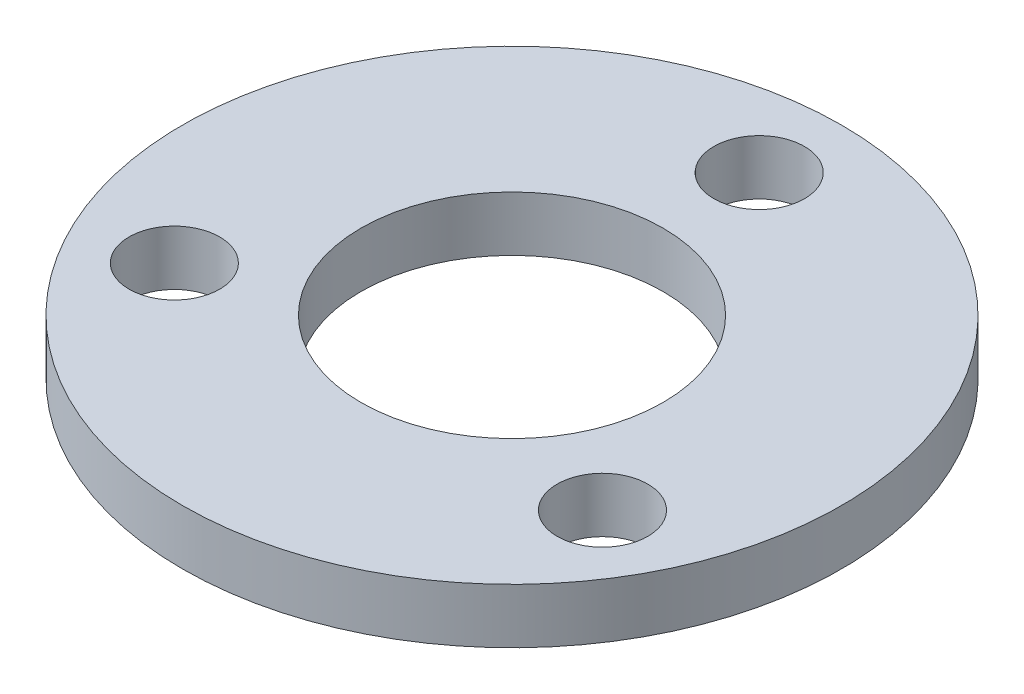
from build123d import *

# Parameters (mm, degrees)
SKETCH_1_R      = 12
SKETCH_1_R_2    = 1.65
SKETCH_1_R_3    = 5.5
EXTRUDE_1_DEPTH = 2


with BuildPart() as part:
    # Эскиз1 → Бобышка-Вытянуть1 (new body)
    with BuildSketch(Plane(origin=(0, 0, 0), x_dir=(1, 0, 0), z_dir=(0, 1, 0))):
        with Locations(Location((0, 0, 0), (0, 0, 270))):
            Circle(SKETCH_1_R)
        with Locations(Location((0, 9, 0), (0, 0, 270))):
            Circle(SKETCH_1_R_2, mode=Mode.SUBTRACT)
        with Locations(Location((7.794228634, -4.5, 0), (0, 0, 270))):
            Circle(SKETCH_1_R_2, mode=Mode.SUBTRACT)
        with Locations(Location((-7.794228634, -4.5, 0), (0, 0, 270))):
            Circle(SKETCH_1_R_2, mode=Mode.SUBTRACT)
        with Locations(Location((0, 0, 0), (0, 0, 270))):
            Circle(SKETCH_1_R_3, mode=Mode.SUBTRACT)
    extrude(amount=EXTRUDE_1_DEPTH)


solid = part.part
